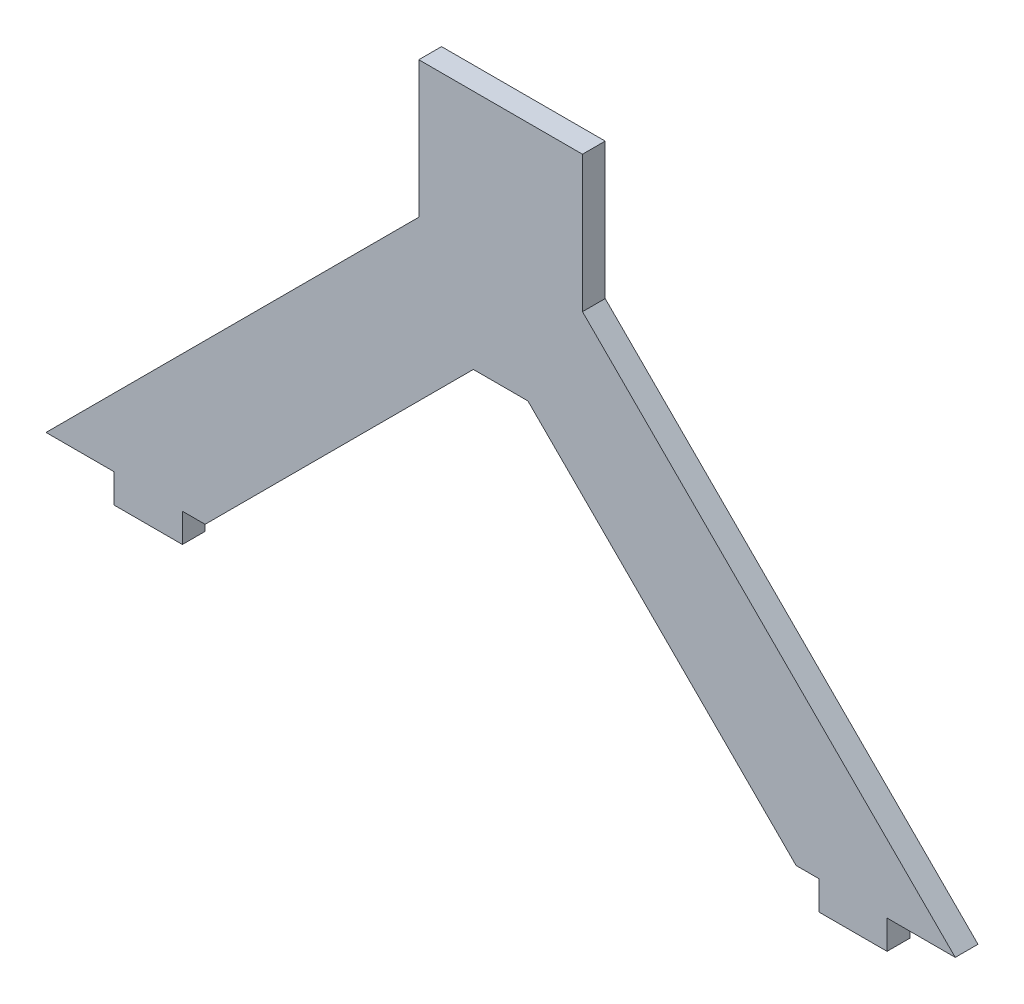
from build123d import *

# Parameters (mm, degrees)
BOSS_EXTRUDE1_DEPTH = 5


with BuildPart() as part:
    # Sketch1 → Boss-Extrude1 (new body)
    with BuildSketch(Plane.XY):
        Polygon((30, 0), (15, 0), (15, 6.35), (0, 6.35), (82, 88.35), (82, 118.35), (118, 118.35), (118, 88.35), (200, 6.35), (185, 6.35), (185, 0), (170, 0), (170, 6.35), (165, 6.35), (106, 65.35), (94, 65.35), (35, 6.35), (30, 6.35), align=None)
    extrude(amount=BOSS_EXTRUDE1_DEPTH)


solid = part.part
